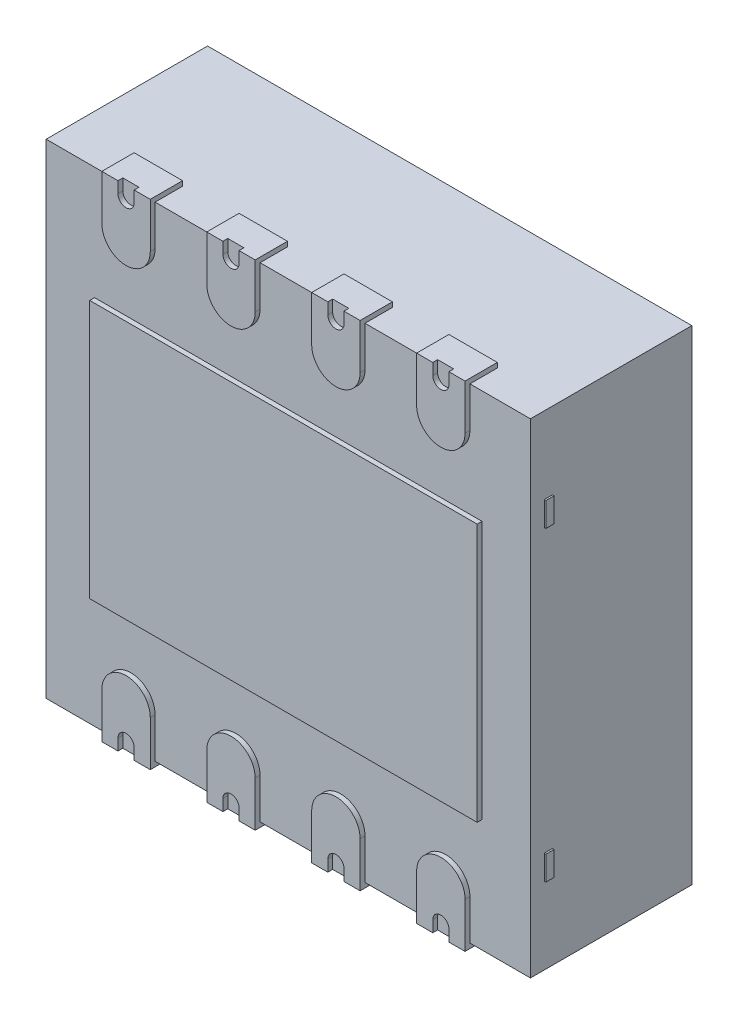
from build123d import *

# Parameters (mm, degrees)
SKETCH1_W            = 3
SKETCH1_H            = 3
BOSS_EXTRUDE1_DEPTH  = 1
SKETCH2_W            = 2.4
SKETCH2_H            = 1.6
BOSS_EXTRUDE2_DEPTH  = 0.03
SKETCH4_W            = 3.940543401
SKETCH4_H            = 3.843561114
SKETCH4_W_2          = 3
SKETCH4_H_2          = 3
CUT_EXTRUDE1_DEPTH   = 60.05
SKETCH7_W            = 0.3
SKETCH7_H            = 0.2
BOSS_EXTRUDE3_DEPTH  = 0.03
CUT_EXTRUDE2_DEPTH   = 0.03
SKETCH9_W            = 0.05
SKETCH9_H            = 0.15
BOSS_EXTRUDE4_DEPTH  = 0.01
BOSS_EXTRUDE9_DEPTH  = 0.01
BOSS_EXTRUDE10_DEPTH = 0.01


with BuildPart() as part:
    # Sketch1 → Boss-Extrude1 (new body)
    with BuildSketch(Plane.XY):
        Rectangle(SKETCH1_W, SKETCH1_H)
    extrude(amount=-BOSS_EXTRUDE1_DEPTH)

    # Sketch2 → Boss-Extrude2 (add)
    with BuildSketch(Plane(origin=(0, 0, 0), x_dir=(-1, 0, 0), z_dir=(0, 0, 1))):
        Rectangle(SKETCH2_W, SKETCH2_H)
        with BuildLine():
            Line((-1.125, 1.25), (-1.125, 1.603517793))
            ThreePointArc((-1.125, 1.603517793), (-0.975, 1.753517793), (-0.825, 1.603517793))
            Line((-0.825, 1.603517793), (-0.825, 1.25))
            ThreePointArc((-0.825, 1.25), (-0.975, 1.1), (-1.125, 1.25))
        make_face()
        with BuildLine():
            Line((-0.175, 1.25), (-0.175, 1.603517793))
            ThreePointArc((-0.175, 1.603517793), (-0.325, 1.753517793), (-0.475, 1.603517793))
            Line((-0.475, 1.603517793), (-0.475, 1.25))
            ThreePointArc((-0.475, 1.25), (-0.325, 1.1), (-0.175, 1.25))
        make_face()
        with BuildLine():
            Line((0.475, 1.25), (0.475, 1.603517793))
            ThreePointArc((0.475, 1.603517793), (0.325, 1.753517793), (0.175, 1.603517793))
            Line((0.175, 1.603517793), (0.175, 1.25))
            ThreePointArc((0.175, 1.25), (0.325, 1.1), (0.475, 1.25))
        make_face()
        with BuildLine():
            Line((1.125, 1.25), (1.125, 1.603517793))
            ThreePointArc((1.125, 1.603517793), (0.975, 1.753517793), (0.825, 1.603517793))
            Line((0.825, 1.603517793), (0.825, 1.25))
            ThreePointArc((0.825, 1.25), (0.975, 1.1), (1.125, 1.25))
        make_face()
        with BuildLine():
            Line((-1.125, -1.25), (-1.125, -1.603517793))
            ThreePointArc((-1.125, -1.603517793), (-0.975, -1.753517793), (-0.825, -1.603517793))
            Line((-0.825, -1.603517793), (-0.825, -1.25))
            ThreePointArc((-0.825, -1.25), (-0.975, -1.1), (-1.125, -1.25))
        make_face()
        with BuildLine():
            Line((-0.475, -1.25), (-0.475, -1.603517793))
            ThreePointArc((-0.475, -1.603517793), (-0.325, -1.753517793), (-0.175, -1.603517793))
            Line((-0.175, -1.603517793), (-0.175, -1.25))
            ThreePointArc((-0.175, -1.25), (-0.325, -1.1), (-0.475, -1.25))
        make_face()
        with BuildLine():
            Line((0.175, -1.25), (0.175, -1.603517793))
            ThreePointArc((0.175, -1.603517793), (0.325, -1.753517793), (0.475, -1.603517793))
            Line((0.475, -1.603517793), (0.475, -1.25))
            ThreePointArc((0.475, -1.25), (0.325, -1.1), (0.175, -1.25))
        make_face()
        with BuildLine():
            Line((0.825, -1.25), (0.825, -1.603517793))
            ThreePointArc((0.825, -1.603517793), (0.975, -1.753517793), (1.125, -1.603517793))
            Line((1.125, -1.603517793), (1.125, -1.25))
            ThreePointArc((1.125, -1.25), (0.975, -1.1), (0.825, -1.25))
        make_face()
    extrude(amount=BOSS_EXTRUDE2_DEPTH)

    # Sketch4 → Cut-Extrude1 (cut)
    with BuildSketch(Plane(origin=(0, 0, -1), x_dir=(-1, 0, 0), z_dir=(0, 0, -1))):
        with Locations((-0.076564963, -0.022969489)):
            Rectangle(SKETCH4_W, SKETCH4_H)
        Rectangle(SKETCH4_W_2, SKETCH4_H_2, mode=Mode.SUBTRACT)
    extrude(amount=-CUT_EXTRUDE1_DEPTH, mode=Mode.SUBTRACT)

    # Sketch7 → Boss-Extrude3 (add)
    with BuildSketch(Plane.XZ.offset(1.5)):
        with Locations((0.975, -0.07)):
            Rectangle(SKETCH7_W, SKETCH7_H)
        with Locations((0.325, -0.07)):
            Rectangle(SKETCH7_W, SKETCH7_H)
        with Locations((-0.325, -0.07)):
            Rectangle(SKETCH7_W, SKETCH7_H)
        with Locations((-0.975, -0.07)):
            Rectangle(SKETCH7_W, SKETCH7_H)
    boss_extrude3 = extrude(amount=BOSS_EXTRUDE3_DEPTH)

    # Mirror1: Boss-Extrude3 across plane
    add(boss_extrude3.mirror(Plane.ZX))

    # Sketch8 → Cut-Extrude2 (cut)
    with BuildSketch(Plane(origin=(0, 0, 0.03), x_dir=(-1, 0, 0), z_dir=(0, 0, 1))):
        with BuildLine():
            Line((-0.925, 1.609812611), (-0.925, 1.459812611))
            ThreePointArc((-0.925, 1.459812611), (-0.975, 1.409812611), (-1.025, 1.459812611))
            Line((-1.025, 1.459812611), (-1.025, 1.609812611))
            ThreePointArc((-1.025, 1.609812611), (-0.975, 1.659812611), (-0.925, 1.609812611))
        make_face()
        with BuildLine():
            Line((-0.375, 1.609812611), (-0.375, 1.459812611))
            ThreePointArc((-0.375, 1.459812611), (-0.325, 1.409812611), (-0.275, 1.459812611))
            Line((-0.275, 1.459812611), (-0.275, 1.609812611))
            ThreePointArc((-0.275, 1.609812611), (-0.325, 1.659812611), (-0.375, 1.609812611))
        make_face()
        with BuildLine():
            Line((0.275, 1.609812611), (0.275, 1.459812611))
            ThreePointArc((0.275, 1.459812611), (0.325, 1.409812611), (0.375, 1.459812611))
            Line((0.375, 1.459812611), (0.375, 1.609812611))
            ThreePointArc((0.375, 1.609812611), (0.325, 1.659812611), (0.275, 1.609812611))
        make_face()
        with BuildLine():
            Line((0.925, 1.609812611), (0.925, 1.459812611))
            ThreePointArc((0.925, 1.459812611), (0.975, 1.409812611), (1.025, 1.459812611))
            Line((1.025, 1.459812611), (1.025, 1.609812611))
            ThreePointArc((1.025, 1.609812611), (0.975, 1.659812611), (0.925, 1.609812611))
        make_face()
        with BuildLine():
            Line((-0.925, -1.609812611), (-0.925, -1.459812611))
            ThreePointArc((-0.925, -1.459812611), (-0.975, -1.409812611), (-1.025, -1.459812611))
            Line((-1.025, -1.459812611), (-1.025, -1.609812611))
            ThreePointArc((-1.025, -1.609812611), (-0.975, -1.659812611), (-0.925, -1.609812611))
        make_face()
        with BuildLine():
            Line((-0.275, -1.609812611), (-0.275, -1.459812611))
            ThreePointArc((-0.275, -1.459812611), (-0.325, -1.409812611), (-0.375, -1.459812611))
            Line((-0.375, -1.459812611), (-0.375, -1.609812611))
            ThreePointArc((-0.375, -1.609812611), (-0.325, -1.659812611), (-0.275, -1.609812611))
        make_face()
        with BuildLine():
            Line((0.375, -1.609812611), (0.375, -1.459812611))
            ThreePointArc((0.375, -1.459812611), (0.325, -1.409812611), (0.275, -1.459812611))
            Line((0.275, -1.459812611), (0.275, -1.609812611))
            ThreePointArc((0.275, -1.609812611), (0.325, -1.659812611), (0.375, -1.609812611))
        make_face()
        with BuildLine():
            Line((1.025, -1.609812611), (1.025, -1.459812611))
            ThreePointArc((1.025, -1.459812611), (0.975, -1.409812611), (0.925, -1.459812611))
            Line((0.925, -1.459812611), (0.925, -1.609812611))
            ThreePointArc((0.925, -1.609812611), (0.975, -1.659812611), (1.025, -1.609812611))
        make_face()
    extrude(amount=-CUT_EXTRUDE2_DEPTH, mode=Mode.SUBTRACT)

    # Sketch9 → Boss-Extrude4 (add)
    with BuildSketch(Plane.ZY.offset(1.5)):
        with Locations((-0.110800284, 0.948643646)):
            Rectangle(SKETCH9_W, SKETCH9_H)
        with Locations((-0.110800284, -0.948643646)):
            Rectangle(SKETCH9_W, SKETCH9_H)
    boss_extrude4 = extrude(amount=BOSS_EXTRUDE4_DEPTH)

    # Mirror2: Boss-Extrude4 across plane
    add(boss_extrude4.mirror(Plane(origin=(0, 0, 0), x_dir=(0, 0, 1), z_dir=(1, 0, 0))))

    # Sketch11 → Boss-Extrude9 (add)
    # profile 1 of 2: a face of its own
    with BuildSketch(Plane(origin=(0, 0, -1), x_dir=(-1, 0, 0), z_dir=(0, 0, -1))):
        with BuildLine():
            Line((-0.805854291, 1.038109942), (-0.423255467, 0.605441833))
            Line((-0.423255467, 0.605441833), (-0.423255467, 1.038109942))
            Line((-0.423255467, 1.038109942), (-0.097177649, 1.038109942))
            Line((-0.097177649, 1.038109942), (0.052640904, 0.796577554))
            Line((0.052640904, 0.796577554), (0.201820168, 1.038109942))
            Line((0.201820168, 1.038109942), (0.943650762, 1.038109942))
            ThreePointArc((0.943650762, 1.038109942), (1.045474138, 0.995933319), (1.087650762, 0.894109942))
            Line((1.087650762, 0.894109942), (1.087650762, 0.670379201))
            ThreePointArc((1.087650762, 0.670379201), (1.045474138, 0.568555824), (0.943650762, 0.526379201))
            Line((0.943650762, 0.526379201), (0.543475021, 0.526379201))
            Line((0.543475021, 0.526379201), (0.543475021, 0.206356726))
            Line((0.543475021, 0.206356726), (0.201820168, 0.206356726))
            Line((0.201820168, 0.206356726), (0.052640904, 0.446858476))
            Line((0.052640904, 0.446858476), (-0.093279754, 0.210602016))
            Line((-0.093279754, 0.210602016), (-0.396062037, 0.210602016))
            Line((-0.396062037, 0.210602016), (-0.788189355, 0.654045576))
            Line((-0.788189355, 0.654045576), (-0.788189355, 0.214790298))
            Line((-0.788189355, 0.214790298), (-1.067573051, 0.214790298))
            Line((-1.067573051, 0.214790298), (-1.067573051, 1.038109942))
            Line((-1.067573051, 1.038109942), (-0.805854291, 1.038109942))
        make_face()
        Polygon((-0.362302815, 0.999733668), (-0.118839535, 0.999733668), (0.05523679, 0.721091876), (0.222284334, 0.999733668), (0.465308002, 0.999733668), (0.23905049, 0.622327348), (0.473025575, 0.247806363), (0.231595523, 0.247806363), (0.05523679, 0.530101575), (-0.112552144, 0.250223114), (-0.362302815, 0.250223114), (-0.125560237, 0.626220348), align=None, mode=Mode.SUBTRACT)
        with BuildLine():
            Line((0.51730694, 0.999733668), (0.910767238, 0.994219094))
            ThreePointArc((0.910767238, 0.994219094), (1.011989543, 0.950619639), (1.052735051, 0.84821519))
            Line((1.052735051, 0.84821519), (1.050676437, 0.701334767))
            ThreePointArc((1.050676437, 0.701334767), (1.007797951, 0.600818431), (0.906690578, 0.559352812))
            Line((0.906690578, 0.559352812), (0.501176929, 0.559352812))
            Line((0.501176929, 0.559352812), (0.501176929, 0.269954806))
            Line((0.501176929, 0.269954806), (0.288716116, 0.622327348))
            Line((0.288716116, 0.622327348), (0.51730694, 0.999733668))
        make_face(mode=Mode.SUBTRACT)
        Polygon((-1.028178054, 0.254481122), (-1.028178054, 0.991192026), (-0.812896495, 0.991192026), (-0.374426195, 0.481817999), (-0.374426195, 0.939702526), (-0.178785, 0.626220348), (-0.398074818, 0.261293182), (-0.82547709, 0.757809403), (-0.82547709, 0.254481122), align=None, mode=Mode.SUBTRACT)
    # profile 2 of 2: a face of its own
    with BuildSketch(Plane(origin=(0, 0, -1), x_dir=(-1, 0, 0), z_dir=(0, 0, -1))):
        with BuildLine():
            Line((0.501176929, 0.890202885), (0.501176929, 0.670379201))
            Line((0.501176929, 0.670379201), (0.874246648, 0.670379201))
            ThreePointArc((0.874246648, 0.670379201), (0.908187774, 0.684438075), (0.922246648, 0.718379201))
            Line((0.922246648, 0.718379201), (0.922246648, 0.842202885))
            ThreePointArc((0.922246648, 0.842202885), (0.908187774, 0.876144011), (0.874246648, 0.890202885))
            Line((0.874246648, 0.890202885), (0.501176929, 0.890202885))
        make_face()
        with BuildLine():
            Line((0.539738286, 0.850364718), (0.829407549, 0.850364718))
            ThreePointArc((0.829407549, 0.850364718), (0.863348674, 0.836305844), (0.877407549, 0.802364718))
            Line((0.877407549, 0.802364718), (0.877407549, 0.760827608))
            ThreePointArc((0.877407549, 0.760827608), (0.863348674, 0.726886482), (0.829407549, 0.712827608))
            Line((0.829407549, 0.712827608), (0.539738286, 0.712827608))
            Line((0.539738286, 0.712827608), (0.539738286, 0.850364718))
        make_face(mode=Mode.SUBTRACT)
    extrude(amount=BOSS_EXTRUDE9_DEPTH)

    # Sketch12 → Boss-Extrude10 (add)
    # profile 1 of 7: a face of its own
    with BuildSketch(Plane(origin=(0, 0, -1), x_dir=(-1, 0, 0), z_dir=(0, 0, -1))):
        Polygon((-1.037035456, -0.548636153), (-0.821650841, -0.548636153), (-0.821650841, -0.620431025), (-0.893445713, -0.620431025), (-0.893445713, -0.948636153), (-0.965240585, -0.948636153), (-0.965240585, -0.620431025), (-1.037035456, -0.620431025), align=None)
    # profile 2 of 7: a face of its own
    with BuildSketch(Plane(origin=(0, 0, -1), x_dir=(-1, 0, 0), z_dir=(0, 0, -1))):
        with BuildLine():
            Line((-0.662676482, -0.548636153), (-0.59088161, -0.548636153))
            Line((-0.59088161, -0.548636153), (-0.59088161, -0.814181025))
            add(Edge.make_bspline(
                [(-0.59088161, -0.814181025), (-0.590907932, -0.819256306), (-0.59095865, -0.82903537), (-0.591466423, -0.843113611), (-0.592153022, -0.856021258), (-0.59314179, -0.867737628), (-0.594610382, -0.878262153), (-0.596272382, -0.887621092), (-0.59810603, -0.895852581), (-0.60120351, -0.905064896), (-0.606012259, -0.915266488), (-0.613268798, -0.926285657), (-0.622305512, -0.935859438), (-0.632712821, -0.944175372), (-0.644578415, -0.950760019), (-0.657628938, -0.95551942), (-0.671822672, -0.958362719), (-0.681653617, -0.958712489), (-0.686714944, -0.958892564)],
                knots=[0, 0, 0, 0, 1.22248561, 2.355488409, 3.392943897, 4.335991845, 5.186735882, 5.951517034, 6.625683685, 7.215700098, 8.28923535, 9.333114649, 10.380102123, 11.447198135, 12.530158036, 13.633358744, 14.781567393, 16, 16, 16, 16], degree=3))
            add(Edge.make_bspline(
                [(-0.686714944, -0.958892564), (-0.691988385, -0.958729304), (-0.702389672, -0.958407292), (-0.717644229, -0.955664578), (-0.732305766, -0.951267182), (-0.746298431, -0.944909075), (-0.759813927, -0.936944688), (-0.772606962, -0.92706564), (-0.784944636, -0.915578324), (-0.792258484, -0.906763247), (-0.796009815, -0.902241923)],
                knots=[0, 0, 0, 0, 0.990984786, 1.954608977, 2.90473533, 3.862451285, 4.837525908, 5.848096122, 6.896271184, 8, 8, 8, 8], degree=3))
            Line((-0.796009815, -0.902241923), (-0.741682892, -0.852001538))
            add(Edge.make_bspline(
                [(-0.741682892, -0.852001538), (-0.738838396, -0.85521786), (-0.733515579, -0.861236464), (-0.72549425, -0.86908487), (-0.718258579, -0.875390159), (-0.711437736, -0.87993822), (-0.70500107, -0.883144096), (-0.698810093, -0.885453379), (-0.692671821, -0.886760564), (-0.688616691, -0.886987017), (-0.686634815, -0.887097692)],
                knots=[0, 0, 0, 0, 1.529509877, 2.862124173, 3.996688592, 4.944357383, 5.774364335, 6.554177287, 7.293378699, 8, 8, 8, 8], degree=3))
            add(Edge.make_bspline(
                [(-0.686634815, -0.887097692), (-0.68471658, -0.886997659), (-0.681028445, -0.886805329), (-0.675957117, -0.884667333), (-0.671681662, -0.881310591), (-0.668866954, -0.87745158), (-0.66707324, -0.873506631), (-0.665952494, -0.869693232), (-0.664888904, -0.865122), (-0.66403678, -0.859795227), (-0.663392913, -0.853643431), (-0.663071992, -0.846741295), (-0.66268171, -0.839051521), (-0.662678287, -0.833679547), (-0.662676482, -0.830847692)],
                knots=[0, 0, 0, 0, 1.003927327, 1.930222208, 2.840933547, 3.835773585, 4.407906147, 5.114514582, 5.922289074, 6.876303333, 7.950072246, 9.174518422, 10.510537432, 12, 12, 12, 12], degree=3))
            Line((-0.662676482, -0.830847692), (-0.662676482, -0.548636153))
        make_face()
    # profile 3 of 7: a face of its own
    with BuildSketch(Plane(origin=(0, 0, -1), x_dir=(-1, 0, 0), z_dir=(0, 0, -1))):
        Polygon((-0.375416867, -0.548636153), (-0.308830328, -0.548636153), (-0.147291867, -0.948636153), (-0.223974559, -0.948636153), (-0.255064303, -0.866584871), (-0.429343149, -0.866584871), (-0.460432892, -0.948636153), (-0.537035456, -0.948636153), align=None)
        Polygon((-0.342163662, -0.65592782), (-0.402099559, -0.79479), (-0.282227764, -0.79479), align=None, mode=Mode.SUBTRACT)
    # profile 4 of 7: a face of its own
    with BuildSketch(Plane(origin=(0, 0, -1), x_dir=(-1, 0, 0), z_dir=(0, 0, -1))):
        Polygon((-0.045448918, -0.548636153), (0.065528646, -0.548636153), (0.065528646, -0.948636153), (-0.006266226, -0.948636153), (-0.006266226, -0.61530282), (-0.088317508, -0.61530282), align=None)
    # profile 5 of 7: a face of its own
    with BuildSketch(Plane(origin=(0, 0, -1), x_dir=(-1, 0, 0), z_dir=(0, 0, -1))):
        Polygon((0.349663261, -0.538379743), (0.424503005, -0.538379743), (0.424503005, -0.799918205), (0.460400441, -0.799918205), (0.460400441, -0.866584871), (0.424503005, -0.866584871), (0.424503005, -0.948636153), (0.352708133, -0.948636153), (0.352708133, -0.866584871), (0.183477364, -0.866584871), (0.183477364, -0.793908589), align=None)
        Polygon((0.352708133, -0.799918205), (0.352708133, -0.663780384), (0.264166467, -0.799918205), align=None, mode=Mode.SUBTRACT)
    # profile 6 of 7: a face of its own
    with BuildSketch(Plane(origin=(0, 0, -1), x_dir=(-1, 0, 0), z_dir=(0, 0, -1))):
        Polygon((0.657355569, -0.538379743), (0.732195313, -0.538379743), (0.732195313, -0.799918205), (0.768092749, -0.799918205), (0.768092749, -0.866584871), (0.732195313, -0.866584871), (0.732195313, -0.948636153), (0.660400441, -0.948636153), (0.660400441, -0.866584871), (0.491169672, -0.866584871), (0.491169672, -0.793908589), align=None)
        Polygon((0.660400441, -0.799918205), (0.660400441, -0.663780384), (0.571858774, -0.799918205), align=None, mode=Mode.SUBTRACT)
    # profile 7 of 7: a face of its own
    with BuildSketch(Plane(origin=(0, 0, -1), x_dir=(-1, 0, 0), z_dir=(0, 0, -1))):
        Polygon((0.877628005, -0.548636153), (0.988605569, -0.548636153), (0.988605569, -0.948636153), (0.916810697, -0.948636153), (0.916810697, -0.61530282), (0.834759415, -0.61530282), align=None)
    extrude(amount=BOSS_EXTRUDE10_DEPTH)


solid = part.part
